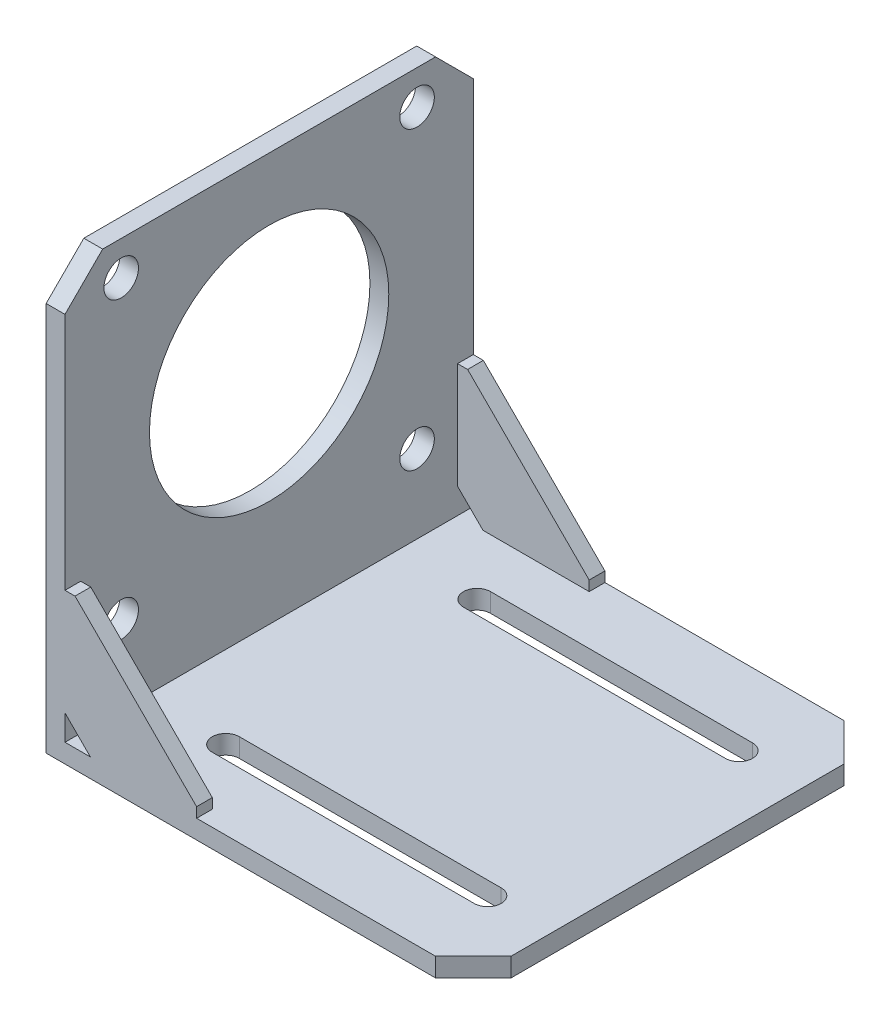
from build123d import *

# Parameters (mm, degrees)
BOSS_EXTRUDE1_DEPTH = 65
CHAMFER1_SIZE       = 6
BOSS_EXTRUDE2_DEPTH = 2.5
SKETCH3_R           = 19.05
SKETCH3_R_2         = 2.75
CUT_EXTRUDE1_DEPTH  = 3
CUT_EXTRUDE2_DEPTH  = 3


with BuildPart() as part:
    # Sketch1 → Boss-Extrude1 (new body)
    with BuildSketch(Plane.XY):
        Polygon((0, 0), (0, 68), (3, 68), (3, 3), (68, 3), (68, 0), align=None)
    extrude(amount=BOSS_EXTRUDE1_DEPTH)

    # Chamfer1
    chamfer1_edges = [part.edges().sort_by_distance(p)[0] for p in [
        (1.5, 68, 65),
        (1.5, 68, 0),
        (68, 1.5, 65),
        (68, 1.5, 0),
    ]]
    chamfer(chamfer1_edges, length=CHAMFER1_SIZE)

    # Sketch2 → Boss-Extrude2 (add)
    with BuildSketch(Plane.XY.offset(65)):
        Polygon((4.600185007, 23.955878092), (23.955878092, 4.600185007), (23.955878092, 3), (7.047822016, 3), (3, 7.047822016), (3, 23.955878092), align=None)
    boss_extrude2 = extrude(amount=-BOSS_EXTRUDE2_DEPTH)

    # Mirror1: Boss-Extrude2 across plane
    add(boss_extrude2.mirror(Plane.XY.offset(32.5)))

    # Sketch3 → Cut-Extrude1 (cut)
    with BuildSketch(Plane.ZY):
        with Locations((32.5, 39)):
            Circle(SKETCH3_R)
        with Locations((8.95, 62.55)):
            Circle(SKETCH3_R_2)
        with Locations((56.05, 62.55)):
            Circle(SKETCH3_R_2)
        with Locations((8.95, 15.45)):
            Circle(SKETCH3_R_2)
        with Locations((56.05, 15.45)):
            Circle(SKETCH3_R_2)
    extrude(amount=-CUT_EXTRUDE1_DEPTH, mode=Mode.SUBTRACT)

    # Sketch4 → Cut-Extrude2 (cut)
    with BuildSketch(Plane.XZ):
        with BuildLine():
            Line((16.1, 54.65), (57.8, 54.65))
            ThreePointArc((57.8, 54.65), (59.95, 52.5), (57.8, 50.35))
            Line((57.8, 50.35), (16.1, 50.35))
            ThreePointArc((16.1, 50.35), (13.95, 52.5), (16.1, 54.65))
        make_face()
        with BuildLine():
            Line((16.1, 14.65), (57.8, 14.65))
            ThreePointArc((57.8, 14.65), (59.95, 12.5), (57.8, 10.35))
            Line((57.8, 10.35), (16.1, 10.35))
            ThreePointArc((16.1, 10.35), (13.95, 12.5), (16.1, 14.65))
        make_face()
    extrude(amount=-CUT_EXTRUDE2_DEPTH, mode=Mode.SUBTRACT)


solid = part.part
